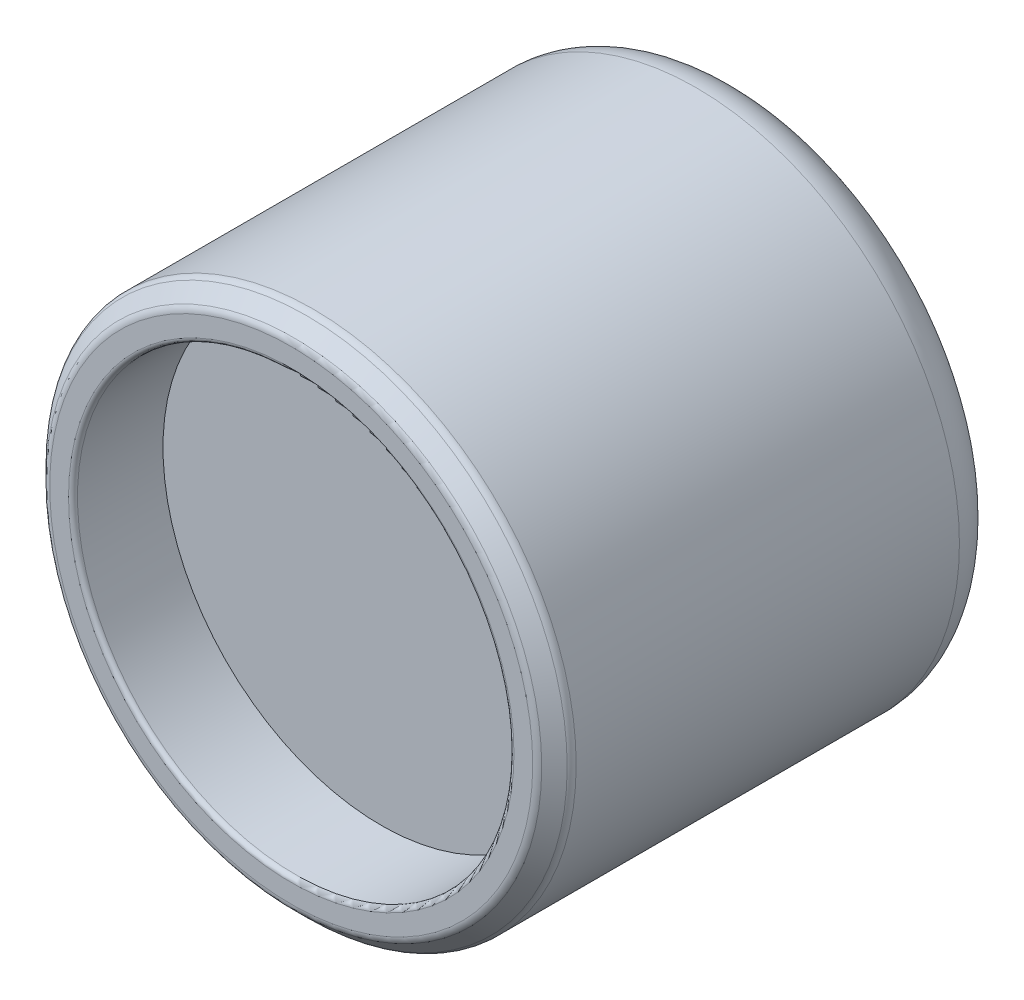
from build123d import *

# Parameters (mm, degrees)
SKETCH1_R           = 58.5
BOSS_EXTRUDE2_DEPTH = 100
SKETCH3_R           = 48.5
CUT_EXTRUDE1_DEPTH  = 20
FILLET1_R           = 1
CHAMFER1_SIZE       = 4
FILLET3_R           = 2
FILLET4_R           = 10


with BuildPart() as part:
    # Sketch1 → Boss-Extrude2 (new body)
    with BuildSketch(Plane.XY):
        Circle(SKETCH1_R)
    extrude(amount=BOSS_EXTRUDE2_DEPTH)

    # Sketch3 → Cut-Extrude1 (cut)
    with BuildSketch(Plane.XY.offset(100)):
        Circle(SKETCH3_R)
    extrude(amount=-CUT_EXTRUDE1_DEPTH, mode=Mode.SUBTRACT)

    # Fillet1
    fillet1_edges = [part.edges().sort_by_distance(p)[0] for p in [
        (-48.5, 0, 100),
    ]]
    fillet(fillet1_edges, radius=FILLET1_R)

    # Chamfer1
    chamfer1_edges = [part.edges().sort_by_distance(p)[0] for p in [
        (-58.5, 0, 100),
    ]]
    chamfer(chamfer1_edges, length=CHAMFER1_SIZE)

    # Fillet3
    fillet3_edges = [part.edges().sort_by_distance(p)[0] for p in [
        (-54.5, 0, 100),
        (-58.5, 0, 96),
    ]]
    fillet(fillet3_edges, radius=FILLET3_R)

    # Fillet4
    fillet4_edges = [part.edges().sort_by_distance(p)[0] for p in [
        (-58.5, 0, 0),
    ]]
    fillet(fillet4_edges, radius=FILLET4_R)


solid = part.part
